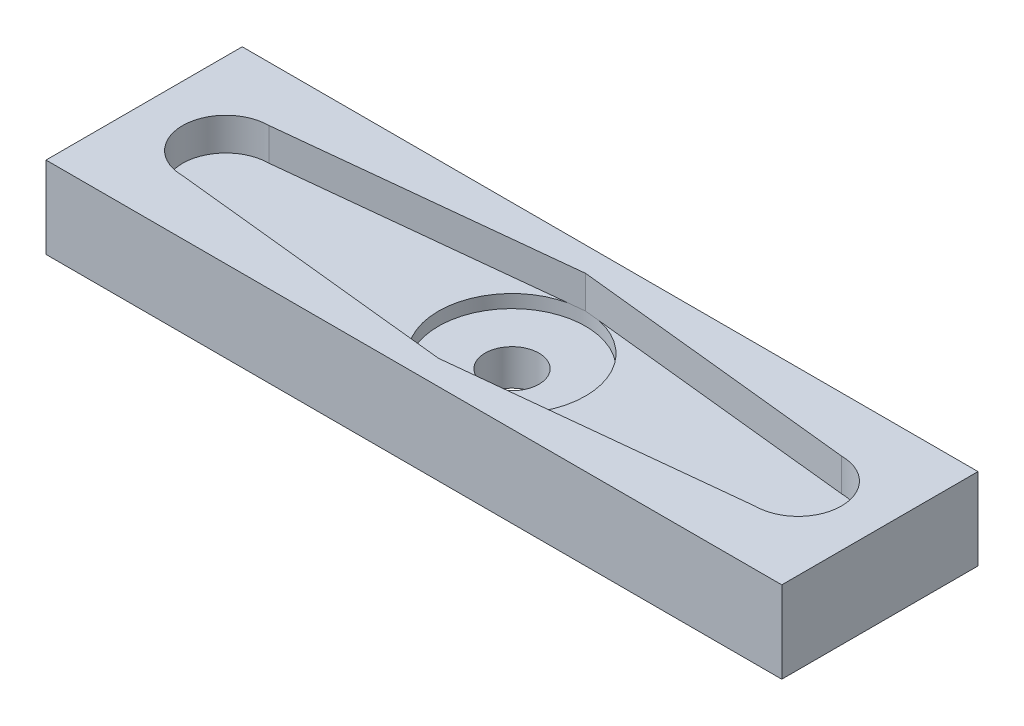
from build123d import *

# Parameters (mm, degrees)
SKETCH1_W           = 45
SKETCH1_H           = 12
BOSS_EXTRUDE1_DEPTH = 5
SKETCH2_R           = 2.65
CUT_EXTRUDE1_DEPTH  = 2
SKETCH3_R           = 1.65
CUT_EXTRUDE2_DEPTH  = 12
SKETCH4_R           = 4.5
CUT_EXTRUDE3_DEPTH  = 0.8


with BuildPart() as part:
    # Sketch1 → Boss-Extrude1 (new body)
    with BuildSketch(Plane(origin=(0, 0, 0), x_dir=(1, 0, 0), z_dir=(0, 1, 0))):
        Rectangle(SKETCH1_W, SKETCH1_H)
    extrude(amount=BOSS_EXTRUDE1_DEPTH)

    # Sketch2 → Cut-Extrude1 (cut)
    with BuildSketch(Plane(origin=(0, 5, 0), x_dir=(1, 0, 0), z_dir=(0, 1, 0))):
        with Locations((-17.5, 0)):
            Circle(SKETCH2_R)
        with BuildLine():
            Line((-0.940913384, 4.400532014), (-17.5, 2.65))
            ThreePointArc((-17.5, 2.65), (-15.62616703, 1.87383297), (-14.85, 0))
            ThreePointArc((-14.85, 0), (-15.62616703, -1.87383297), (-17.5, -2.65))
            Line((-17.5, -2.65), (-0.940913384, -4.400532014))
            ThreePointArc((-0.940913384, -4.400532014), (-4.5, 0), (-0.940913384, 4.400532014))
        make_face()
        with BuildLine():
            Line((0, 4.5), (-0.940913384, 4.400532014))
            ThreePointArc((-0.940913384, 4.400532014), (-4.5, 0), (-0.940913384, -4.400532014))
            Line((-0.940913384, -4.400532014), (0, -4.5))
            Line((0, -4.5), (0.940913384, -4.400532014))
            ThreePointArc((0.940913384, -4.400532014), (3.498864832, -2.829831247), (4.5, 0))
            ThreePointArc((4.5, 0), (3.498864832, 2.829831247), (0.940913384, 4.400532014))
            Line((0.940913384, 4.400532014), (0, 4.5))
        make_face()
        with BuildLine():
            Line((17.5, 2.65), (0.940913384, 4.400532014))
            ThreePointArc((0.940913384, 4.400532014), (3.498864832, 2.829831247), (4.5, 0))
            ThreePointArc((4.5, 0), (3.498864832, -2.829831247), (0.940913384, -4.400532014))
            Line((0.940913384, -4.400532014), (17.5, -2.65))
            ThreePointArc((17.5, -2.65), (14.85, 0), (17.5, 2.65))
        make_face()
        with Locations((17.5, 0)):
            Circle(SKETCH2_R)
    extrude(amount=-CUT_EXTRUDE1_DEPTH, mode=Mode.SUBTRACT)

    # Sketch3 → Cut-Extrude2 (cut)
    with BuildSketch(Plane(origin=(0, 3, 0), x_dir=(1, 0, 0), z_dir=(0, 1, 0))):
        with Locations(Location((0, 0, 0), (0, 0, 270))):
            Circle(SKETCH3_R)
    extrude(amount=-CUT_EXTRUDE2_DEPTH, mode=Mode.SUBTRACT)

    # Sketch4 → Cut-Extrude3 (cut)
    with BuildSketch(Plane(origin=(0, 3, 0), x_dir=(1, 0, 0), z_dir=(0, 1, 0))):
        with Locations(Location((0, 0, 0), (0, 0, 270))):
            Circle(SKETCH4_R)
    extrude(amount=-CUT_EXTRUDE3_DEPTH, mode=Mode.SUBTRACT)


solid = part.part
